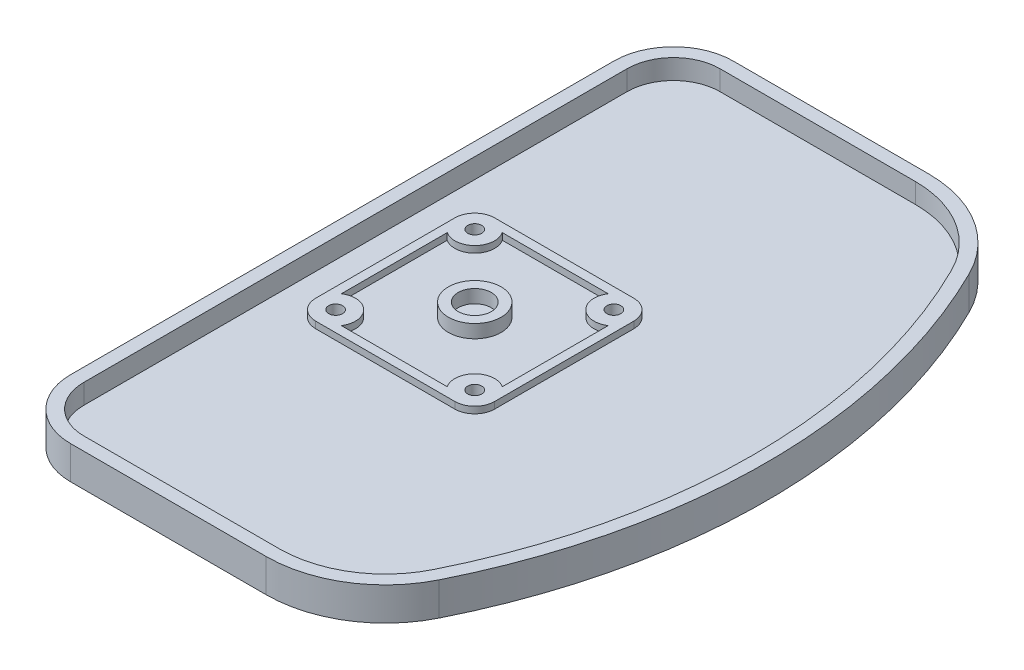
from build123d import *

# Parameters (mm, degrees)
EXTRUDE_1_DEPTH              = 5
FILLET_1_R                   = 9
FILLET_2_R                   = 18
SHELL_1_T                    = -2
SKETCH_2_W                   = 27
SKETCH_2_H                   = 27
EXTRUDE_2_DEPTH              = 1
SKETCH_3_R                   = 3.975
EXTRUDE_3_DEPTH              = 1
FILLET_3_R                   = 3
HOLE_WIZARD_M2_1_D           = 2.1
HOLE_WIZARD_M2_1_CBORE_D     = 3.8
HOLE_WIZARD_M2_1_CBORE_DEPTH = 1
PATTERN_CIRCULAR_1_COUNT     = 4
SKETCH_6_R                   = 3.975
CUT_EXTRUDE_1_DEPTH          = 1
SKETCH_7_R                   = 2.5
CUT_EXTRUDE_2_DEPTH          = 2


with BuildPart() as part:
    # ｽｹｯﾁ1 → ﾎﾞｽ - 押し出し1 (new body)
    with BuildSketch(Plane(origin=(0, 0, 0), x_dir=(1, 0, 0), z_dir=(0, 1, 0))):
        with BuildLine():
            Line((-20, 50), (28.833147735, 50))
            ThreePointArc((28.833147735, 50), (44, 0), (28.833147735, -50))
            Line((28.833147735, -50), (-20, -50))
            Line((-20, -50), (-20, 50))
        make_face()
    extrude(amount=EXTRUDE_1_DEPTH)

    # ﾌｨﾚｯﾄ1
    fillet_1_edges = [part.edges().sort_by_distance(p)[0] for p in [
        (-20, 2.5, -50),
        (-20, 2.5, 50),
    ]]
    fillet(fillet_1_edges, radius=FILLET_1_R)

    # ﾌｨﾚｯﾄ2
    fillet_2_edges = [part.edges().sort_by_distance(p)[0] for p in [
        (28.833147735, 2.5, -50),
        (28.833147735, 2.5, 50),
    ]]
    fillet(fillet_2_edges, radius=FILLET_2_R)

    # ｼｪﾙ1
    shell_1_openings = [part.faces().sort_by_distance(p)[0] for p in [
        (9.782139289, 5, 0),
    ]]
    offset(amount=SHELL_1_T, openings=shell_1_openings, kind=Kind.INTERSECTION)

    # ｽｹｯﾁ2 → ﾎﾞｽ - 押し出し2 (add)
    with BuildSketch(Plane(origin=(0, 2, 0), x_dir=(1, 0, 0), z_dir=(0, 1, 0))):
        Rectangle(SKETCH_2_W, SKETCH_2_H)
    extrude(amount=EXTRUDE_2_DEPTH)

    # ｽｹｯﾁ3 → ﾎﾞｽ - 押し出し3 (add)
    with BuildSketch(Plane(origin=(0, 3, 0), x_dir=(1, 0, 0), z_dir=(0, 1, 0))):
        with Locations(Location((0, 0, 0), (0, 0, 270))):
            Circle(SKETCH_3_R)
    extrude(amount=EXTRUDE_3_DEPTH)

    # ﾌｨﾚｯﾄ3
    fillet_3_edges = [part.edges().sort_by_distance(p)[0] for p in [
        (13.5, 2.5, 13.5),
        (13.5, 2.5, -13.5),
        (-13.5, 2.5, -13.5),
        (-13.5, 2.5, 13.5),
    ]]
    fillet(fillet_3_edges, radius=FILLET_3_R)

    # M2 なべ頭ねじ用座ぐり穴1 (through all)
    with Locations(Plane(origin=(0, 0, 0), x_dir=(-1, 0, 0), z_dir=(0, -1, 0))):
        with Locations((10.5, 10.5)):
            hole_wizard_m2_1 = CounterBoreHole(HOLE_WIZARD_M2_1_D / 2, HOLE_WIZARD_M2_1_CBORE_D / 2, HOLE_WIZARD_M2_1_CBORE_DEPTH)

    # 円形ﾊﾟﾀｰﾝ1: M2 なべ頭ねじ用座ぐり穴1 ×4 about axis
    pattern_circular_1_axis = Axis((0, 0, 0), (0, 1, 0))
    for i in range(1, PATTERN_CIRCULAR_1_COUNT):
        add(hole_wizard_m2_1.rotate(pattern_circular_1_axis, i * 360 / PATTERN_CIRCULAR_1_COUNT), mode=Mode.SUBTRACT)

    # ｽｹｯﾁ6 → ｶｯﾄ - 押し出し1 (cut)
    with BuildSketch(Plane(origin=(0, 3, 0), x_dir=(1, 0, 0), z_dir=(0, 1, 0))):
        with BuildLine():
            Line((-7.994506037, -12.15), (7.994506037, -12.15))
            ThreePointArc((7.994506037, -12.15), (8.378679656, -8.378679656), (12.15, -7.994506037))
            Line((12.15, -7.994506037), (12.15, 7.994506037))
            ThreePointArc((12.15, 7.994506037), (8.378679656, 8.378679656), (7.994506037, 12.15))
            Line((7.994506037, 12.15), (-7.994506037, 12.15))
            ThreePointArc((-7.994506037, 12.15), (-7.62628447, 11.36125435), (-7.5, 10.5))
            ThreePointArc((-7.5, 10.5), (-9.076975053, 7.858977471), (-12.15, 7.994506037))
            Line((-12.15, 7.994506037), (-12.15, -7.994506037))
            ThreePointArc((-12.15, -7.994506037), (-9.076975053, -7.858977471), (-7.5, -10.5))
            ThreePointArc((-7.5, -10.5), (-7.62628447, -11.36125435), (-7.994506037, -12.15))
        make_face()
        with Locations(Location((0, 0, 0), (0, 0, 270))):
            Circle(SKETCH_6_R, mode=Mode.SUBTRACT)
    extrude(amount=-CUT_EXTRUDE_1_DEPTH, mode=Mode.SUBTRACT)

    # ｽｹｯﾁ7 → ｶｯﾄ - 押し出し2 (cut)
    with BuildSketch(Plane(origin=(0, 4, 0), x_dir=(1, 0, 0), z_dir=(0, 1, 0))):
        with Locations(Location((0, 0, 0), (0, 0, 270))):
            Circle(SKETCH_7_R)
    extrude(amount=-CUT_EXTRUDE_2_DEPTH, mode=Mode.SUBTRACT)


solid = part.part
